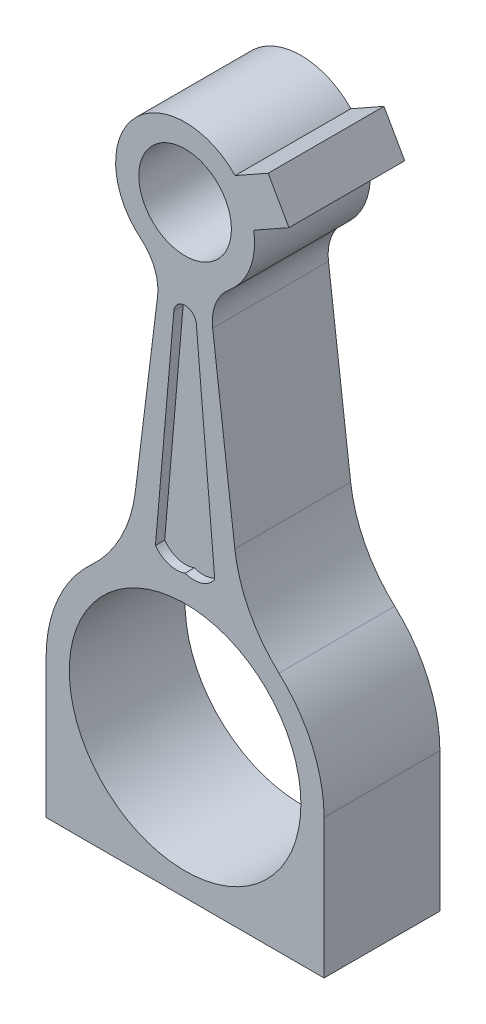
from build123d import *

# Parameters (mm, degrees)
SKETCH1_R           = 25
SKETCH1_R_2         = 10
BOSS_EXTRUDE1_DEPTH = 25
CUT_EXTRUDE1_DEPTH  = 2


with BuildPart() as part:
    # Sketch1 → Boss-Extrude1 (new body)
    with BuildSketch(Plane.XY):
        with BuildLine():
            Line((-5.9495669, 79.464935133), (-10.735337561, 40.593572422))
            ThreePointArc((-10.735337561, 40.593572422), (-13.846128401, 30.51133724), (-20.2552595, 22.12971899))
            ThreePointArc((-20.2552595, 22.12971899), (-27.455944575, 12.090124379), (-30, 0))
            Line((-30, 0), (-30, -30))
            Line((-30, -30), (30, -30))
            Line((30, -30), (30, 0))
            ThreePointArc((30, 0), (27.455944575, 12.090124379), (20.2552595, 22.12971899))
            ThreePointArc((20.2552595, 22.12971899), (13.846128401, 30.51133724), (10.735337561, 40.593572422))
            Line((10.735337561, 40.593572422), (5.9495669, 79.464935133))
            ThreePointArc((5.9495669, 79.464935133), (6.588547568, 84.397513141), (9.524776428, 88.412134191))
            ThreePointArc((9.524776428, 88.412134191), (14.000335083, 94.615706401), (14.834877403, 102.219552307))
            Line((14.834877403, 102.219552307), (22.415220632, 106.480398828))
            Line((22.415220632, 106.480398828), (17.935698756, 114.427937641))
            Line((17.935698756, 114.427937641), (10.795365576, 110.41441703))
            ThreePointArc((10.795365576, 110.41441703), (-11.019469666, 110.176997999), (-9.524776428, 88.412134191))
            ThreePointArc((-9.524776428, 88.412134191), (-6.588547568, 84.397513141), (-5.9495669, 79.464935133))
        make_face()
        Circle(SKETCH1_R, mode=Mode.SUBTRACT)
        with Locations((0, 100)):
            Circle(SKETCH1_R_2, mode=Mode.SUBTRACT)
    extrude(amount=BOSS_EXTRUDE1_DEPTH)

    # Sketch2 → Cut-Extrude1 (cut)
    with BuildSketch(Plane.XY.offset(25)):
        with BuildLine():
            Line((-2.424018912, 78.51885418), (-6.403368912, 32.676732655))
            ThreePointArc((-6.403368912, 32.676732655), (-3.537609758, 30.601194917), (0, 30.677021255))
            ThreePointArc((0, 30.677021255), (3.537609758, 30.601194917), (6.403368912, 32.676732655))
            Line((6.403368912, 32.676732655), (2.424018912, 78.51885418))
            ThreePointArc((2.424018912, 78.51885418), (0, 80.741469231), (-2.424018912, 78.51885418))
        make_face()
    extrude(amount=-CUT_EXTRUDE1_DEPTH, mode=Mode.SUBTRACT)


solid = part.part
